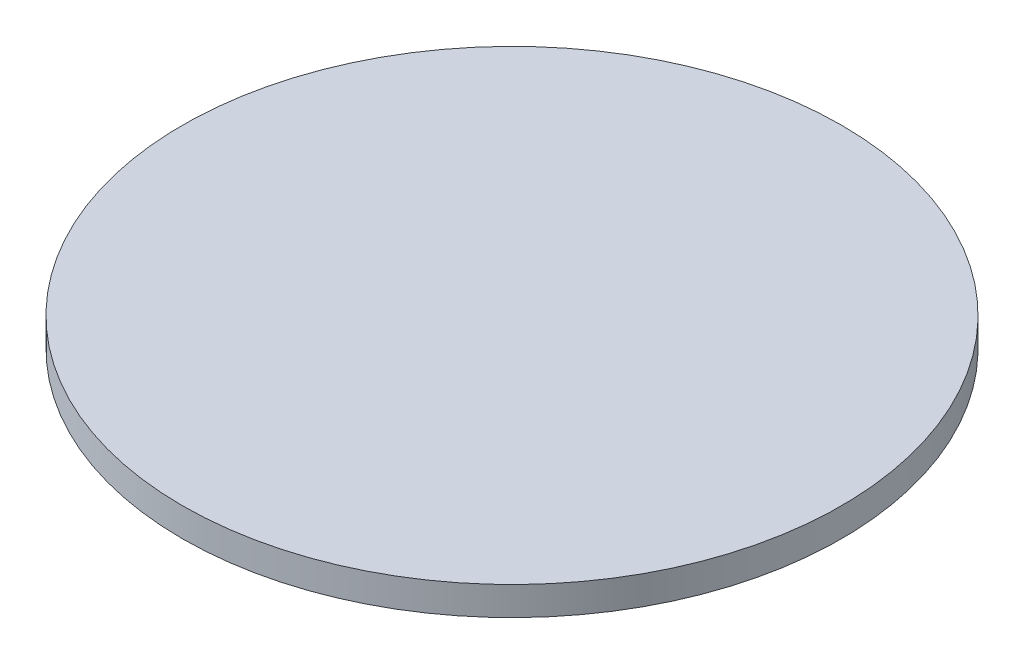
from build123d import *

# Parameters (mm, degrees)
SKETCH1_R           = 11.5
BOSS_EXTRUDE1_DEPTH = 1


with BuildPart() as part:
    # Sketch1 → Boss-Extrude1 (new body)
    with BuildSketch(Plane(origin=(0, 0, 0), x_dir=(1, 0, 0), z_dir=(0, 1, 0))):
        with Locations(Location((0, 0, 0), (0, 0, 270))):
            Circle(SKETCH1_R)
    extrude(amount=BOSS_EXTRUDE1_DEPTH)


solid = part.part
